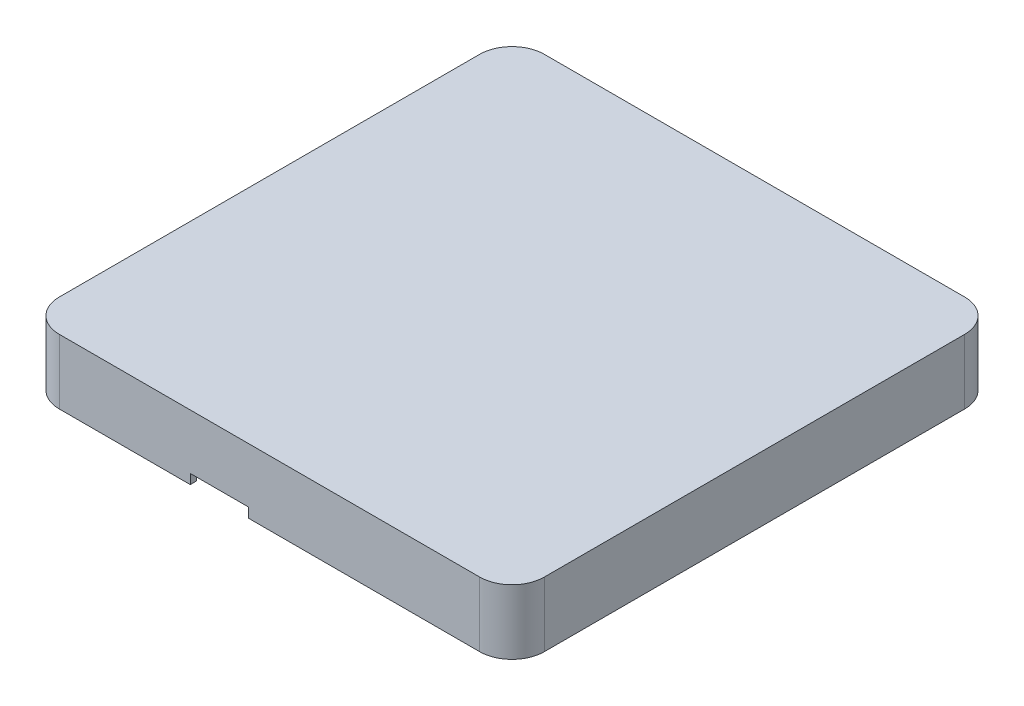
from build123d import *

# Parameters (mm, degrees)
SZKIC1_W                    = 75
SZKIC1_H                    = 75
DODANIE_WYCI_GNI_CIE1_DEPTH = 10
ZAOKR_GLENIE1_R             = 5
WYTNIJ_WYCI_GNI_CIE1_DEPTH  = 8
WYTNIJ_WYCI_GNI_CIE2_DEPTH  = 4
SZKIC7_R                    = 1.9
SZKIC7_R_2                  = 0.9
SZKIC7_R_3                  = 1.900523095
SZKIC7_R_4                  = 0.900523095
DODANIE_WYCI_GNI_CIE2_DEPTH = 8.7
SZKIC9_R                    = 0.900523095
SZKIC9_R_2                  = 0.9
DODANIE_WYCI_GNI_CIE3_DEPTH = 1
SZKIC10_R                   = 1.25
DODANIE_WYCI_GNI_CIE4_DEPTH = 1
SZKIC11_R                   = 2
SZKIC11_R_2                 = 1.25
DODANIE_WYCI_GNI_CIE5_DEPTH = 8.5
WYTNIJ_WYCI_GNI_CIE20_DEPTH = 10
SZKIC22_W                   = 4
SZKIC22_H                   = 1
DODANIE_WYCI_GNI_CIE6_DEPTH = 0.3
SZKIC24_W                   = 4
SZKIC24_H                   = 1
DODANIE_WYCI_GNI_CIE7_DEPTH = 0.3
WYTNIJ_WYCI_GNI_CIE13_DEPTH = 55
WYTNIJ_WYCI_GNI_CIE14_DEPTH = 55


with BuildPart() as part:
    # Szkic1 → Dodanie-wyciągnięcie1 (new body)
    with BuildSketch(Plane(origin=(0, 0, 0), x_dir=(1, 0, 0), z_dir=(0, 1, 0))):
        with Locations((37.5, 37.5)):
            Rectangle(SZKIC1_W, SZKIC1_H)
    extrude(amount=DODANIE_WYCI_GNI_CIE1_DEPTH)

    # Zaokrąglenie1
    zaokr_glenie1_edges = [part.edges().sort_by_distance(p)[0] for p in [
        (0, 5, 0),
        (0, 5, -75),
        (75, 5, -75),
        (75, 5, 0),
    ]]
    fillet(zaokr_glenie1_edges, radius=ZAOKR_GLENIE1_R)

    # Szkic4 → Wytnij-wyciągnięcie1 (cut)
    with BuildSketch(Plane(origin=(0, 10, 0), x_dir=(1, 0, 0), z_dir=(0, 1, 0))):
        with BuildLine():
            Line((2, 70), (2, 5))
            ThreePointArc((2, 5), (2.878679656, 2.878679656), (5, 2))
            Line((5, 2), (70, 2))
            ThreePointArc((70, 2), (72.121320344, 2.878679656), (73, 5))
            Line((73, 5), (73, 70))
            ThreePointArc((73, 70), (72.121320344, 72.121320344), (70, 73))
            Line((70, 73), (5, 73))
            ThreePointArc((5, 73), (2.878679656, 72.121320344), (2, 70))
        make_face()
    extrude(amount=-WYTNIJ_WYCI_GNI_CIE1_DEPTH, mode=Mode.SUBTRACT)

    # Szkic6 → Wytnij-wyciągnięcie2 (cut)
    with BuildSketch(Plane(origin=(0, 10, 0), x_dir=(1, 0, 0), z_dir=(0, 1, 0))):
        with BuildLine():
            Line((1, 70), (1, 5))
            ThreePointArc((1, 5), (2.171572875, 2.171572875), (5, 1))
            Line((5, 1), (70, 1))
            ThreePointArc((70, 1), (72.828427125, 2.171572875), (74, 5))
            Line((74, 5), (74, 70))
            ThreePointArc((74, 70), (72.828427125, 72.828427125), (70, 74))
            Line((70, 74), (5, 74))
            ThreePointArc((5, 74), (2.171572875, 72.828427125), (1, 70))
        make_face()
        with BuildLine():
            Line((2, 70), (2, 5))
            ThreePointArc((2, 5), (2.878679656, 2.878679656), (5, 2))
            Line((5, 2), (70, 2))
            ThreePointArc((70, 2), (72.121320344, 2.878679656), (73, 5))
            Line((73, 5), (73, 70))
            ThreePointArc((73, 70), (72.121320344, 72.121320344), (70, 73))
            Line((70, 73), (5, 73))
            ThreePointArc((5, 73), (2.878679656, 72.121320344), (2, 70))
        make_face(mode=Mode.SUBTRACT)
    extrude(amount=-WYTNIJ_WYCI_GNI_CIE2_DEPTH, mode=Mode.SUBTRACT)

    # Szkic7 → Dodanie-wyciągnięcie2 (add)
    # profile 1 of 4: a face of its own
    with BuildSketch(Plane(origin=(0, 2, 0), x_dir=(1, 0, 0), z_dir=(0, 1, 0))):
        with Locations(Location((24, 52, 0), (0, 0, 270))):
            Circle(SZKIC7_R)
        with Locations(Location((24, 52, 0), (0, 0, 270))):
            Circle(SZKIC7_R_2, mode=Mode.SUBTRACT)
    # profile 2 of 4: a face of its own
    with BuildSketch(Plane(origin=(0, 2, 0), x_dir=(1, 0, 0), z_dir=(0, 1, 0))):
        with Locations(Location((35.5, 52, 0), (0, 0, 270))):
            Circle(SZKIC7_R_3)
        with Locations(Location((35.5, 52, 0), (0, 0, 270))):
            Circle(SZKIC7_R_4, mode=Mode.SUBTRACT)
    # profile 3 of 4: a face of its own
    with BuildSketch(Plane(origin=(0, 2, 0), x_dir=(1, 0, 0), z_dir=(0, 1, 0))):
        with Locations(Location((35.5, 5, 0), (0, 0, 270))):
            Circle(SZKIC7_R)
        with Locations(Location((35.5, 5, 0), (0, 0, 270))):
            Circle(SZKIC7_R_2, mode=Mode.SUBTRACT)
    # profile 4 of 4: a face of its own
    with BuildSketch(Plane(origin=(0, 2, 0), x_dir=(1, 0, 0), z_dir=(0, 1, 0))):
        with Locations(Location((24, 5, 0), (0, 0, 270))):
            Circle(SZKIC7_R)
        with Locations(Location((24, 5, 0), (0, 0, 270))):
            Circle(SZKIC7_R_2, mode=Mode.SUBTRACT)
    extrude(amount=DODANIE_WYCI_GNI_CIE2_DEPTH)

    # Szkic9 → Dodanie-wyciągnięcie3 (add)
    with BuildSketch(Plane(origin=(0, 2, 0), x_dir=(1, 0, 0), z_dir=(0, 1, 0))):
        with Locations(Location((35.5, 52, 0), (0, 0, 270))):
            Circle(SZKIC9_R)
        with Locations(Location((35.5, 5, 0), (0, 0, 270))):
            Circle(SZKIC9_R_2)
        with Locations(Location((24, 5, 0), (0, 0, 270))):
            Circle(SZKIC9_R_2)
        with Locations(Location((24, 52, 0), (0, 0, 270))):
            Circle(SZKIC9_R_2)
    extrude(amount=DODANIE_WYCI_GNI_CIE3_DEPTH)

    # Szkic10 → Dodanie-wyciągnięcie4 (add)
    with BuildSketch(Plane(origin=(0, 2, 0), x_dir=(1, 0, 0), z_dir=(0, 1, 0))):
        with Locations(Location((67, 23.5, 0), (0, 0, 270))):
            Circle(SZKIC10_R)
        with Locations(Location((67, 8, 0), (0, 0, 270))):
            Circle(SZKIC10_R)
    extrude(amount=DODANIE_WYCI_GNI_CIE4_DEPTH)

    # Szkic11 → Dodanie-wyciągnięcie5 (add)
    # profile 1 of 2: a face of its own
    with BuildSketch(Plane(origin=(0, 2, 0), x_dir=(1, 0, 0), z_dir=(0, 1, 0))):
        with Locations(Location((67, 23.5, 0), (0, 0, 270))):
            Circle(SZKIC11_R)
        with Locations(Location((67, 23.5, 0), (0, 0, 270))):
            Circle(SZKIC11_R_2, mode=Mode.SUBTRACT)
    # profile 2 of 2: a face of its own
    with BuildSketch(Plane(origin=(0, 2, 0), x_dir=(1, 0, 0), z_dir=(0, 1, 0))):
        with Locations(Location((67, 8, 0), (0, 0, 270))):
            Circle(SZKIC11_R)
        with Locations(Location((67, 8, 0), (0, 0, 270))):
            Circle(SZKIC11_R_2, mode=Mode.SUBTRACT)
    extrude(amount=DODANIE_WYCI_GNI_CIE5_DEPTH)

    # Szkic19 → Wytnij-wyciągnięcie20 (cut)
    with BuildSketch(Plane(origin=(0, 0, -2), x_dir=(-1, 0, 0), z_dir=(0, 0, -1))):
        Polygon((-34.25, 10), (-25.25, 10), (-25.25, 8.5), (-26.5, 8.5), (-32.5, 8.5), (-34.25, 8.5), align=None)
    extrude(amount=-WYTNIJ_WYCI_GNI_CIE20_DEPTH, mode=Mode.SUBTRACT)

    # Szkic22 → Dodanie-wyciągnięcie6 (add)
    with BuildSketch(Plane.ZY.offset(-74)):
        with Locations((-37.5, 9.5)):
            Rectangle(SZKIC22_W, SZKIC22_H)
        with Locations((-63, 9.5)):
            Rectangle(SZKIC22_W, SZKIC22_H)
        with Locations((-12, 9.5)):
            Rectangle(SZKIC22_W, SZKIC22_H)
    extrude(amount=DODANIE_WYCI_GNI_CIE6_DEPTH)

    # Szkic24 → Dodanie-wyciągnięcie7 (add)
    with BuildSketch(Plane(origin=(1, 0, 0), x_dir=(0, 0, -1), z_dir=(1, 0, 0))):
        with Locations((12, 9.5)):
            Rectangle(SZKIC24_W, SZKIC24_H)
        with Locations((63, 9.5)):
            Rectangle(SZKIC24_W, SZKIC24_H)
        with Locations((37.5, 9.5)):
            Rectangle(SZKIC24_W, SZKIC24_H)
    extrude(amount=DODANIE_WYCI_GNI_CIE7_DEPTH)

    # Szkic25 → Wytnij-wyciągnięcie13 (cut)
    with BuildSketch(Plane.XY.offset(-10)):
        Polygon((1, 10), (1.3, 9.5), (1.3, 10), align=None)
    extrude(amount=-WYTNIJ_WYCI_GNI_CIE13_DEPTH, mode=Mode.SUBTRACT)

    # Szkic26 → Wytnij-wyciągnięcie14 (cut)
    with BuildSketch(Plane(origin=(0, 0, -65), x_dir=(-1, 0, 0), z_dir=(0, 0, -1))):
        Polygon((-74, 10), (-73.7, 10), (-73.7, 9.5), align=None)
    extrude(amount=-WYTNIJ_WYCI_GNI_CIE14_DEPTH, mode=Mode.SUBTRACT)


with BuildPart() as body_2:
    # Lustro5: mirrored copy
    add(part.part.mirror(Plane.ZX.offset(-10)))


solid = body_2.part
